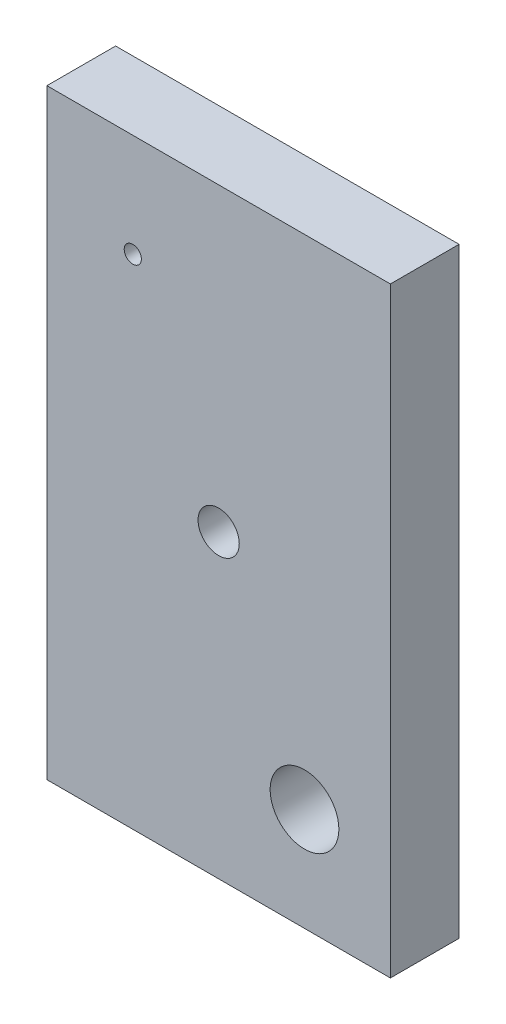
from build123d import *

# Parameters (mm, degrees)
SKETCH1_W                  = 100
SKETCH1_H                  = 175
BOSS_EXTRUDE1_DEPTH        = 20
F_5_0_5_DIAMETER_HOLE1_D   = 5
F_12_0_12_DIAMETER_HOLE1_D = 12
F_20_0_20_DIAMETER_HOLE1_D = 20


with BuildPart() as part:
    # Sketch1 → Boss-Extrude1 (new body)
    with BuildSketch(Plane.XY):
        with Locations((50, 87.5)):
            Rectangle(SKETCH1_W, SKETCH1_H)
    extrude(amount=-BOSS_EXTRUDE1_DEPTH)

    # Ø5.0 (5) Diameter Hole1 (through all)
    with Locations(Plane.XY):
        with Locations((25, 145)):
            Hole(F_5_0_5_DIAMETER_HOLE1_D / 2)

    # Ø12.0 (12) Diameter Hole1 (through all)
    with Locations(Plane.XY):
        with Locations((50, 87.5)):
            Hole(F_12_0_12_DIAMETER_HOLE1_D / 2)

    # Ø20.0 (20) Diameter Hole1 (through all)
    with Locations(Plane.XY):
        with Locations((75, 30)):
            Hole(F_20_0_20_DIAMETER_HOLE1_D / 2)


solid = part.part
